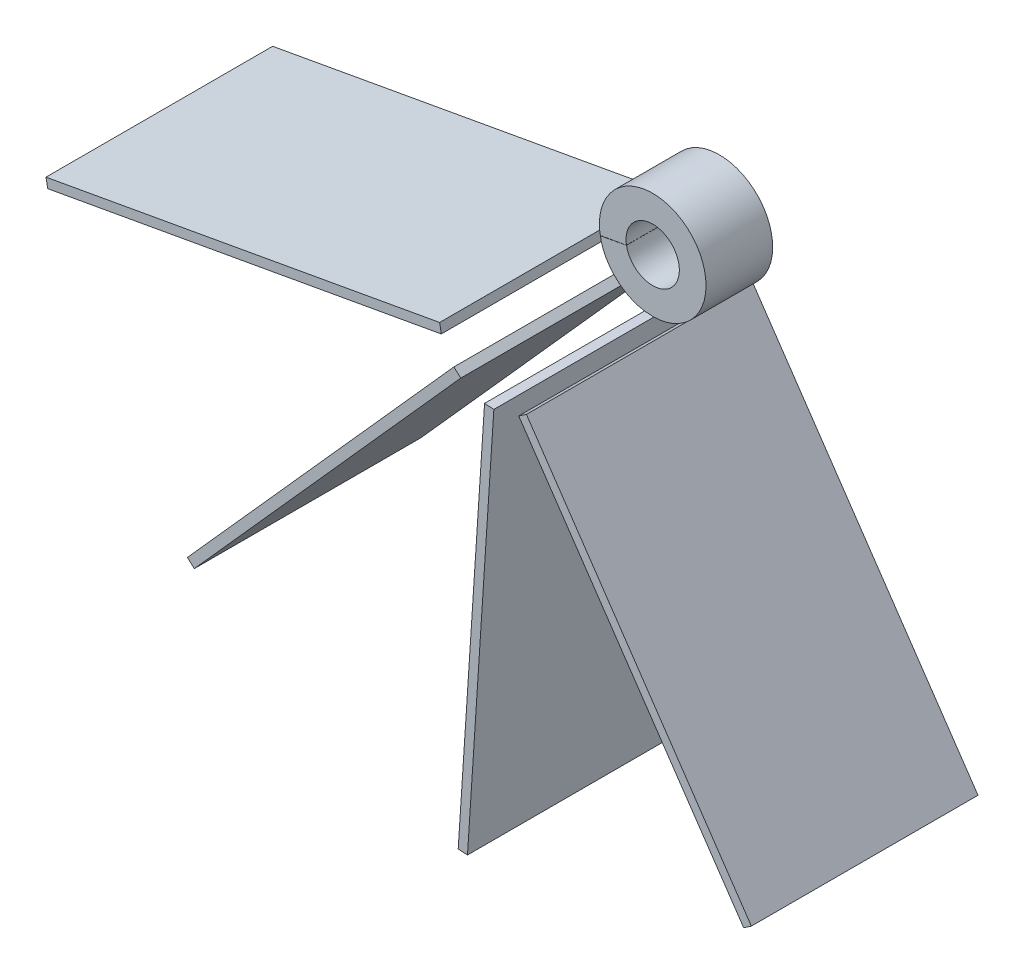
from build123d import *

# Parameters (mm, degrees)
BOSS_EXTRUDE2_DEPTH = 25
BOSS_EXTRUDE3_DEPTH = 60


with BuildPart() as part:
    # Sketch1 → Boss-Extrude2 (new body)
    with BuildSketch(Plane.XY):
        with BuildLine():
            ThreePointArc((-19.272609064, -5.344767522), (-17.431181917, -9.805809349), (-14.574748022, -13.695865072))
            Line((-14.574748022, -13.695865072), (-114.51684862, -125.551023774))
            Line((-114.51684862, -125.551023774), (-111.917163437, -127.873831243))
            Line((-111.917163437, -127.873831243), (-11.975062839, -16.018672542))
            ThreePointArc((-11.975062839, -16.018672542), (-7.744084669, -18.43987941), (-3.053041676, -19.765599827))
            Line((-3.053041676, -19.765599827), (-12.943579656, -169.439168831))
            Line((-12.943579656, -169.439168831), (-9.464936702, -169.66904008))
            Line((-9.464936702, -169.66904008), (0.425601277, -19.995471076))
            ThreePointArc((0.425601277, -19.995471076), (5.250301367, -19.298557862), (9.763088678, -17.455145358))
            Line((9.763088678, -17.455145358), (94.117488701, -141.488750468))
            Line((94.117488701, -141.488750468), (97.000219629, -139.528225031))
            Line((97.000219629, -139.528225031), (12.645819606, -15.494619921))
            ThreePointArc((12.645819606, -15.494619921), (7.698899748, 18.45879039), (-19.907923967, -1.91691505))
            Line((-19.907923967, -1.91691505), (-167.528286005, -28.529481853))
            Line((-167.528286005, -28.529481853), (-166.892971102, -31.957334324))
            Line((-166.892971102, -31.957334324), (-19.272609064, -5.344767522))
        make_face()
        with BuildLine():
            Line((-19.682714938, -3.54834224), (-9.841357469, -1.77417112))
            ThreePointArc((-9.841357469, -1.77417112), (9.836982775, 1.798268581), (-9.832549076, -1.822355255))
            Line((-9.832549076, -1.822355255), (-19.665098151, -3.64471051))
            ThreePointArc((-19.665098151, -3.64471051), (-19.67396555, -3.596537162), (-19.682714938, -3.54834224))
        make_face(mode=Mode.SUBTRACT)
    extrude(amount=BOSS_EXTRUDE2_DEPTH)

    # Sketch2 → Boss-Extrude3 (add)
    with BuildSketch(Plane.XY.offset(25)):
        Polygon((-167.528286005, -28.529481853), (-166.892971102, -31.957334324), (-19.272609064, -5.344767522), (-19.907923967, -1.91691505), align=None)
        Polygon((-14.574748022, -13.695865072), (-11.975062839, -16.018672542), (-111.917163437, -127.873831243), (-114.51684862, -125.551023774), align=None)
        Polygon((-3.053041676, -19.765599827), (0.425601277, -19.995471076), (-9.464936702, -169.66904008), (-12.943579656, -169.439168831), align=None)
        Polygon((9.763088678, -17.455145358), (12.645819606, -15.494619921), (97.000219629, -139.528225031), (94.117488701, -141.488750468), align=None)
    extrude(amount=BOSS_EXTRUDE3_DEPTH)


solid = part.part
